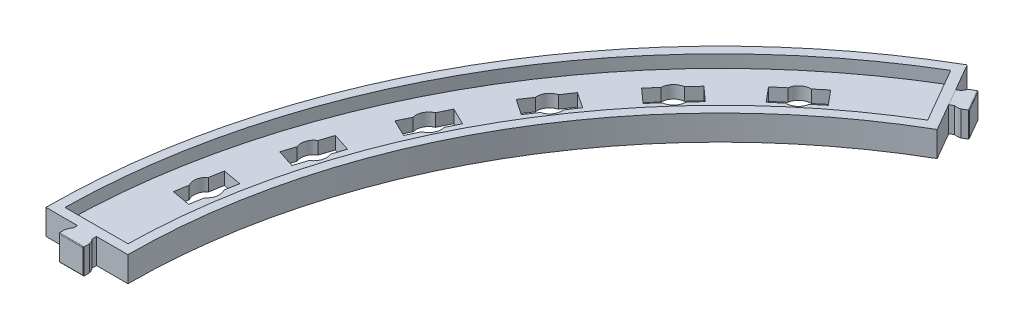
from build123d import *

# Parameters (mm, degrees)
EXTRUDE_1_DEPTH          = 2
EXTRUDE_2_DEPTH          = 2
EXTRUDE_3_DEPTH          = 4
EXTRUDE_4_DEPTH          = 4
CUT_EXTRUDE_1_DEPTH      = 2
PATTERN_CIRCULAR_1_COUNT = 3
PATTERN_CIRCULAR_1_ANGLE = 16
PATTERN_CIRCULAR_2_COUNT = 4
PATTERN_CIRCULAR_2_ANGLE = 24
FILLET_1_R               = 0.1
FILLET_2_R               = 0.1


with BuildPart() as part:
    # 草图1 → 凸台-拉伸1 (new body)
    with BuildSketch(Plane(origin=(0, 0, 0), x_dir=(1, 0, 0), z_dir=(0, 1, 0))):
        with BuildLine():
            Line((-94, 0), (-107, 0))
            ThreePointArc((-107, 0), (-92.664718205, 53.5), (-53.5, 92.664718205))
            Line((-53.5, 92.664718205), (-47, 81.406387956))
            ThreePointArc((-47, 81.406387956), (-81.406387956, 47), (-94, 0))
        make_face()
    extrude(amount=EXTRUDE_1_DEPTH)

    # 草图2 → 凸台-拉伸2 (add)
    with BuildSketch(Plane(origin=(0, 2, 0), x_dir=(1, 0, 0), z_dir=(0, 1, 0))):
        with BuildLine():
            Line((-47, 81.406387956), (-53.5, 92.664718205))
            ThreePointArc((-53.5, 92.664718205), (-92.664718205, 53.5), (-107, 0))
            Line((-107, 0), (-94, 0))
            ThreePointArc((-94, 0), (-81.406387956, 47), (-47, 81.406387956))
        make_face()
        with BuildLine():
            Line((-105.489335954, 1.5), (-95.488219169, 1.5))
            ThreePointArc((-95.488219169, 1.5), (-82.705426061, 47.75), (-49.04314769, 81.945223562))
            Line((-49.04314769, 81.945223562), (-54.043706083, 90.606444764))
            ThreePointArc((-54.043706083, 90.606444764), (-91.365680099, 52.75), (-105.489335954, 1.5))
        make_face(mode=Mode.SUBTRACT)
    extrude(amount=EXTRUDE_2_DEPTH)

    # 草图4 → 凸台-拉伸4 (add)
    with BuildSketch(Plane(origin=(0, 4, 0), x_dir=(1, 0, 0), z_dir=(0, 1, 0))):
        with BuildLine():
            Line((-99, 0), (-102, 0))
            Line((-102, 0), (-102, -0.677124344))
            ThreePointArc((-102, -0.677124344), (-102.280042303, -1.088161527), (-102.45, -1.555590279))
            Line((-102.45, -1.555590279), (-102.45, -2.5))
            Line((-102.45, -2.5), (-98.55, -2.5))
            Line((-98.55, -2.5), (-98.55, -1.555590279))
            ThreePointArc((-98.55, -1.555590279), (-98.719957697, -1.088161527), (-99, -0.677124344))
            Line((-99, -0.677124344), (-99, 0))
        make_face()
    extrude(amount=-EXTRUDE_4_DEPTH)

    # 草图5 → 切除-拉伸1 (cut)
    with BuildSketch(Plane(origin=(0, 2, 0), x_dir=(1, 0, 0), z_dir=(0, 1, 0))):
        with BuildLine():
            Line((-87.44631157, 46.544522694), (-88.400700065, 44.587736295))
            ThreePointArc((-88.400700065, 44.587736295), (-88.53121356, 43.179557959), (-89.560521102, 42.209750769))
            Line((-89.560521102, 42.209750769), (-90.514909597, 40.25296437))
            Line((-90.514909597, 40.25296437), (-93.211291736, 41.56807781))
            Line((-93.211291736, 41.56807781), (-92.256903241, 43.524864209))
            ThreePointArc((-92.256903241, 43.524864209), (-92.126389746, 44.933042546), (-91.097082204, 45.902849736))
            Line((-91.097082204, 45.902849736), (-90.142693709, 47.859636135))
            Line((-90.142693709, 47.859636135), (-87.44631157, 46.544522694))
        make_face()
    cut_extrude_1 = extrude(amount=-CUT_EXTRUDE_1_DEPTH, mode=Mode.SUBTRACT)

    # 阵列(圆周)1: 切除-拉伸1 ×3 about axis
    pattern_circular_1_axis = Axis((0, 0, 0), (0, 1, 0))
    for i in range(1, PATTERN_CIRCULAR_1_COUNT):
        add(cut_extrude_1.rotate(pattern_circular_1_axis, i * PATTERN_CIRCULAR_1_ANGLE / (PATTERN_CIRCULAR_1_COUNT - 1)), mode=Mode.SUBTRACT)

    # 阵列(圆周)2: 切除-拉伸1 ×4 about axis
    pattern_circular_2_axis = Axis((0, 0, 0), (0, -1, 0))
    for i in range(1, PATTERN_CIRCULAR_2_COUNT):
        add(cut_extrude_1.rotate(pattern_circular_2_axis, i * PATTERN_CIRCULAR_2_ANGLE / (PATTERN_CIRCULAR_2_COUNT - 1)), mode=Mode.SUBTRACT)

    # 圆角1
    fillet_1_edges = [part.edges().sort_by_distance(p)[0] for p in [
        (-100.5, 0, 2.5),
        (-98.55, 2, 2.5),
        (-102.45, 2, 2.5),
        (-100.5, 4, 2.5),
    ]]
    fillet(fillet_1_edges, radius=FILLET_1_R)


with BuildPart() as body_2:
    # 草图3 → 凸台-拉伸3 (new body)
    with BuildSketch(Plane(origin=(0, 4, 0), x_dir=(1, 0, 0), z_dir=(0, 1, 0))):
        with BuildLine():
            Line((-49.5, 85.736514975), (-51, 88.334591186))
            Line((-51, 88.334591186), (-50.413593116, 88.673153358))
            ThreePointArc((-50.413593116, 88.673153358), (-50.197645625, 89.121195698), (-49.8778193, 89.502097757))
            Line((-49.8778193, 89.502097757), (-49.059936491, 89.974302618))
            Line((-49.059936491, 89.974302618), (-47.109936491, 86.596803543))
            Line((-47.109936491, 86.596803543), (-47.9278193, 86.124598683))
            ThreePointArc((-47.9278193, 86.124598683), (-48.417603323, 86.03807199), (-48.913593116, 86.075077147))
            Line((-48.913593116, 86.075077147), (-49.5, 85.736514975))
        make_face()
    extrude(amount=-EXTRUDE_3_DEPTH)

    # 圆角2
    fillet_2_edges = [body_2.edges().sort_by_distance(p)[0] for p in [
        (-48.084936491, 4, -88.28555308),
        (-49.059936491, 2, -89.974302618),
        (-47.109936491, 2, -86.596803543),
        (-48.084936491, 0, -88.28555308),
    ]]
    fillet(fillet_2_edges, radius=FILLET_2_R)


solid = Compound([part.part, body_2.part])
